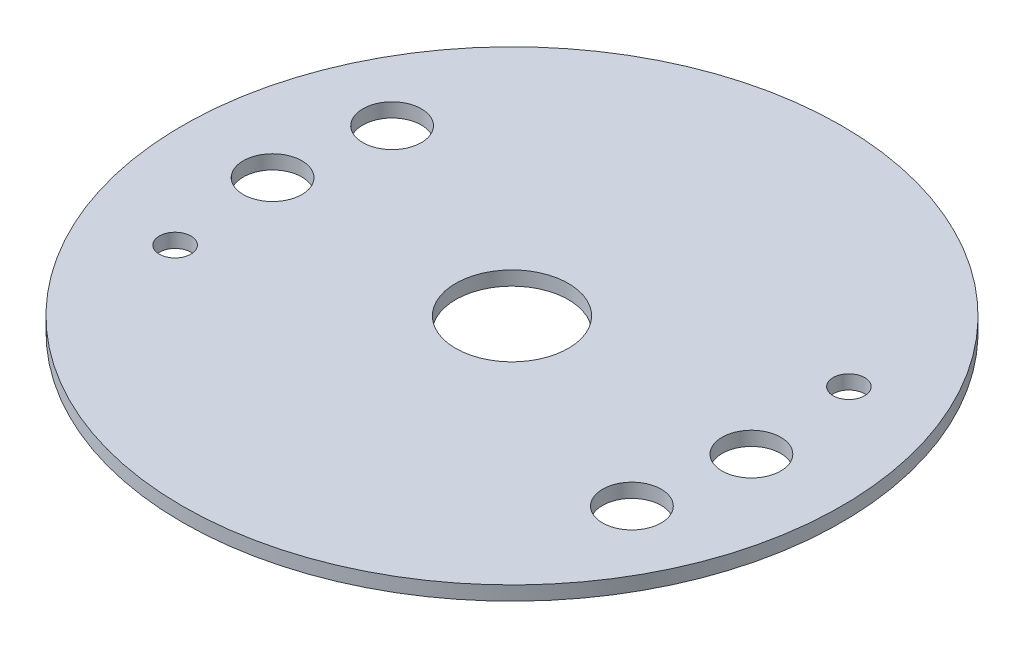
from build123d import *

# Parameters (mm, degrees)
SKETCH1_R           = 74.295
SKETCH1_R_2         = 12.7
BOSS_EXTRUDE1_DEPTH = 3.175
SKETCH2_R           = 6.604
SKETCH2_R_2         = 3.556
CUT_EXTRUDE1_DEPTH  = 3.175


with BuildPart() as part:
    # Sketch1 → Boss-Extrude1 (new body)
    with BuildSketch(Plane(origin=(0, 0, 0), x_dir=(1, 0, 0), z_dir=(0, 1, 0))):
        with Locations(Location((0, 0, 0), (0, 0, 270))):
            Circle(SKETCH1_R)
        with Locations(Location((0, 0, 0), (0, 0, 270))):
            Circle(SKETCH1_R_2, mode=Mode.SUBTRACT)
    extrude(amount=BOSS_EXTRUDE1_DEPTH)

    # Sketch2 → Cut-Extrude1 (cut)
    with BuildSketch(Plane(origin=(0, 3.175, 0), x_dir=(1, 0, 0), z_dir=(0, 1, 0))):
        with Locations(Location((-53.975, 0, 0), (0, 0, 270))):
            Circle(SKETCH2_R)
        with Locations(Location((53.975, 0, 0), (0, 0, 270))):
            Circle(SKETCH2_R)
        with Locations(Location((-51.795490029, -24.152633658, 0), (0, 0, 270))):
            Circle(SKETCH2_R_2)
        with Locations(Location((51.795490029, 24.152633658, 0), (0, 0, 270))):
            Circle(SKETCH2_R_2)
        with Locations(Location((50.64447914, -23.615908466, 0), (0, 0, 270))):
            Circle(SKETCH2_R)
        with Locations(Location((-50.64447914, 23.615908466, 0), (0, 0, 270))):
            Circle(SKETCH2_R)
    extrude(amount=-CUT_EXTRUDE1_DEPTH, mode=Mode.SUBTRACT)


solid = part.part
